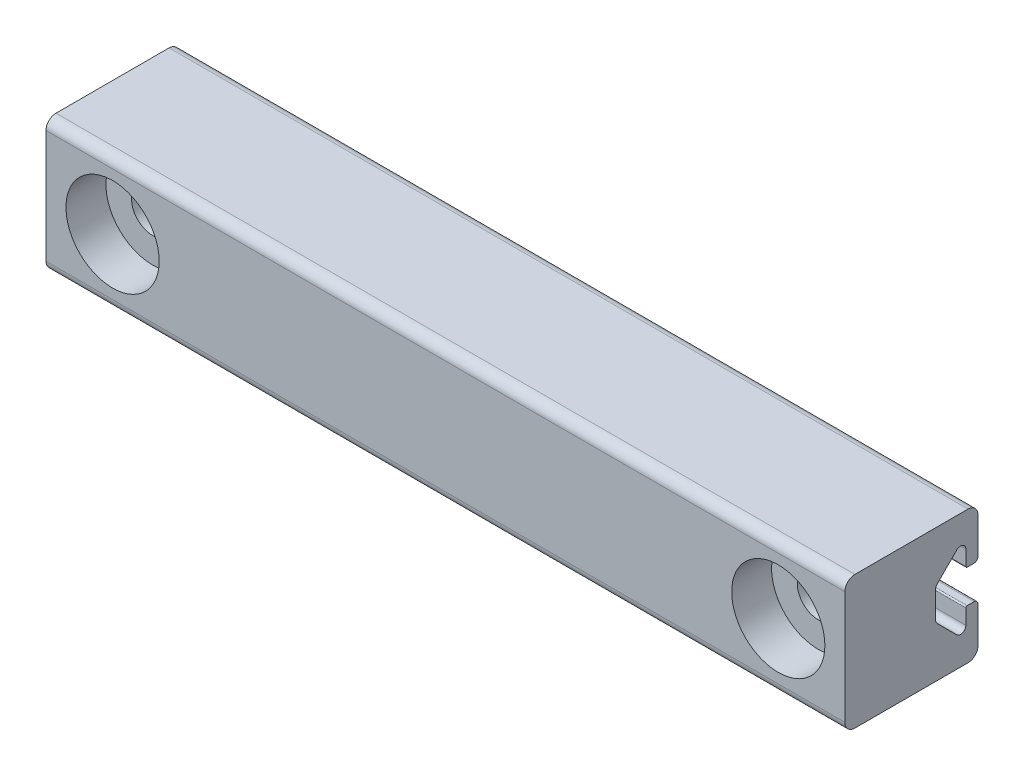
from build123d import *
from build123d.topology import SkipClean

# Parameters (mm, degrees)
BOSS_EXTRUDE1_DEPTH      = 152.4
BOSS_EXTRUDE1_DEPTH_BACK = 152.4
SKETCH4_R                = 2.15
BOSS_EXTRUDE2_DEPTH      = 95.2
SKETCH5_W                = 30
SKETCH5_H                = 30
CUT_EXTRUDE1_DEPTH       = 280
BOSS_EXTRUDE5_START      = -120
BOSS_EXTRUDE5_DEPTH      = 120
SKETCH9_R                = 3.15
CUT_EXTRUDE2_DEPTH       = 155.031685052
SKETCH10_R               = 7
CUT_EXTRUDE3_DEPTH       = 6


with BuildPart() as part:
    # Sketch3 → Boss-Extrude1 (new, two sides: drawn at the far end of the back side and taken through both)
    with BuildSketch(Plane(origin=(0, 0, 0), x_dir=(0, 0, -1), z_dir=(1, 0, 0)).offset(-BOSS_EXTRUDE1_DEPTH_BACK)):
        with BuildLine():
            Line((-5.515685425, 6.807463915), (-2.601114729, 3.892893219))
            ThreePointArc((-2.601114729, 3.892893219), (-2.27669138, 3.676120467), (-1.894007948, 3.6))
            Line((-1.894007948, 3.6), (0, 3.6))
            Line((0, 3.6), (0, 2.15))
            ThreePointArc((0, 2.15), (-1.52027958, 1.52027958), (-2.15, 0))
            Line((-2.15, 0), (-3.6, 0))
            Line((-3.6, 0), (-3.6, 1.894007948))
            ThreePointArc((-3.6, 1.894007948), (-3.676120467, 2.27669138), (-3.892893219, 2.601114729))
            Line((-3.892893219, 2.601114729), (-6.807463915, 5.515685425))
            ThreePointArc((-6.807463915, 5.515685425), (-7.679296086, 5.689103626), (-8.17314934, 4.95))
            Line((-8.17314934, 4.95), (-8.17314934, 2.7))
            ThreePointArc((-8.17314934, 2.7), (-8.231727984, 2.558578644), (-8.37314934, 2.5))
            Line((-8.37314934, 2.5), (-9.4, 2.5))
            ThreePointArc((-9.4, 2.5), (-9.824264069, 2.675735931), (-10, 3.1))
            Line((-10, 3.1), (-10, 8.5))
            ThreePointArc((-10, 8.5), (-9.560660172, 9.560660172), (-8.5, 10))
            Line((-8.5, 10), (-3.1, 10))
            ThreePointArc((-3.1, 10), (-2.675735931, 9.824264069), (-2.5, 9.4))
            Line((-2.5, 9.4), (-2.5, 8.37314934))
            ThreePointArc((-2.5, 8.37314934), (-2.558578644, 8.231727984), (-2.7, 8.17314934))
            Line((-2.7, 8.17314934), (-4.95, 8.17314934))
            ThreePointArc((-4.95, 8.17314934), (-5.689103626, 7.679296086), (-5.515685425, 6.807463915))
        make_face()
    extrude(amount=BOSS_EXTRUDE1_DEPTH + BOSS_EXTRUDE1_DEPTH_BACK)

    # Mirror1: part across plane


with BuildPart() as part_1:
    add(part.part)
    add(part.part.mirror(Plane.ZX))

    # Mirror2: part across plane


with BuildPart() as part_2:
    add(part_1.part)
    add(part_1.part.mirror(Plane.XY))

    # Sketch4 → Boss-Extrude2 (add)
    with SkipClean():  # the faces are left unmerged after this step: merging them gives an invalid solid
        with BuildSketch(Plane(origin=(152.4, 0, 0), x_dir=(0, 0, -1), z_dir=(1, 0, 0))):
            with BuildLine():
                Line((1.894007948, 3.6), (-1.894007948, 3.6))
                ThreePointArc((-1.894007948, 3.6), (-2.27669138, 3.676120467), (-2.601114729, 3.892893219))
                Line((-2.601114729, 3.892893219), (-5.515685425, 6.807463915))
                ThreePointArc((-5.515685425, 6.807463915), (-5.689103626, 7.679296086), (-4.95, 8.17314934))
                Line((-4.95, 8.17314934), (-2.7, 8.17314934))
                ThreePointArc((-2.7, 8.17314934), (-2.558578644, 8.231727984), (-2.5, 8.37314934))
                Line((-2.5, 8.37314934), (-2.5, 9.4))
                ThreePointArc((-2.5, 9.4), (-2.675735931, 9.824264069), (-3.1, 10))
                Line((-3.1, 10), (-8.5, 10))
                ThreePointArc((-8.5, 10), (-9.560660172, 9.560660172), (-10, 8.5))
                Line((-10, 8.5), (-10, 3.1))
                ThreePointArc((-10, 3.1), (-9.824264069, 2.675735931), (-9.4, 2.5))
                Line((-9.4, 2.5), (-8.37314934, 2.5))
                ThreePointArc((-8.37314934, 2.5), (-8.231727984, 2.558578644), (-8.17314934, 2.7))
                Line((-8.17314934, 2.7), (-8.17314934, 4.95))
                ThreePointArc((-8.17314934, 4.95), (-7.679296086, 5.689103626), (-6.807463915, 5.515685425))
                Line((-6.807463915, 5.515685425), (-3.892893219, 2.601114729))
                ThreePointArc((-3.892893219, 2.601114729), (-3.676120467, 2.27669138), (-3.6, 1.894007948))
                Line((-3.6, 1.894007948), (-3.6, -1.894007948))
                ThreePointArc((-3.6, -1.894007948), (-3.676120467, -2.27669138), (-3.892893219, -2.601114729))
                Line((-3.892893219, -2.601114729), (-6.807463915, -5.515685425))
                ThreePointArc((-6.807463915, -5.515685425), (-7.679296086, -5.689103626), (-8.17314934, -4.95))
                Line((-8.17314934, -4.95), (-8.17314934, -2.7))
                ThreePointArc((-8.17314934, -2.7), (-8.231727984, -2.558578644), (-8.37314934, -2.5))
                Line((-8.37314934, -2.5), (-9.4, -2.5))
                ThreePointArc((-9.4, -2.5), (-9.824264069, -2.675735931), (-10, -3.1))
                Line((-10, -3.1), (-10, -8.5))
                ThreePointArc((-10, -8.5), (-9.560660172, -9.560660172), (-8.5, -10))
                Line((-8.5, -10), (-3.1, -10))
                ThreePointArc((-3.1, -10), (-2.675735931, -9.824264069), (-2.5, -9.4))
                Line((-2.5, -9.4), (-2.5, -8.37314934))
                ThreePointArc((-2.5, -8.37314934), (-2.558578644, -8.231727984), (-2.7, -8.17314934))
                Line((-2.7, -8.17314934), (-4.95, -8.17314934))
                ThreePointArc((-4.95, -8.17314934), (-5.689103626, -7.679296086), (-5.515685425, -6.807463915))
                Line((-5.515685425, -6.807463915), (-2.601114729, -3.892893219))
                ThreePointArc((-2.601114729, -3.892893219), (-2.27669138, -3.676120467), (-1.894007948, -3.6))
                Line((-1.894007948, -3.6), (1.894007948, -3.6))
                ThreePointArc((1.894007948, -3.6), (2.27669138, -3.676120467), (2.601114729, -3.892893219))
                Line((2.601114729, -3.892893219), (5.515685425, -6.807463915))
                ThreePointArc((5.515685425, -6.807463915), (5.689103626, -7.679296086), (4.95, -8.17314934))
                Line((4.95, -8.17314934), (2.7, -8.17314934))
                ThreePointArc((2.7, -8.17314934), (2.558578644, -8.231727984), (2.5, -8.37314934))
                Line((2.5, -8.37314934), (2.5, -9.4))
                ThreePointArc((2.5, -9.4), (2.675735931, -9.824264069), (3.1, -10))
                Line((3.1, -10), (8.5, -10))
                ThreePointArc((8.5, -10), (9.560660172, -9.560660172), (10, -8.5))
                Line((10, -8.5), (10, -3.1))
                ThreePointArc((10, -3.1), (9.824264069, -2.675735931), (9.4, -2.5))
                Line((9.4, -2.5), (8.37314934, -2.5))
                ThreePointArc((8.37314934, -2.5), (8.231727984, -2.558578644), (8.17314934, -2.7))
                Line((8.17314934, -2.7), (8.17314934, -4.95))
                ThreePointArc((8.17314934, -4.95), (7.679296086, -5.689103626), (6.807463915, -5.515685425))
                Line((6.807463915, -5.515685425), (3.892893219, -2.601114729))
                ThreePointArc((3.892893219, -2.601114729), (3.676120467, -2.27669138), (3.6, -1.894007948))
                Line((3.6, -1.894007948), (3.6, 1.894007948))
                ThreePointArc((3.6, 1.894007948), (3.676120467, 2.27669138), (3.892893219, 2.601114729))
                Line((3.892893219, 2.601114729), (6.807463915, 5.515685425))
                ThreePointArc((6.807463915, 5.515685425), (7.679296086, 5.689103626), (8.17314934, 4.95))
                Line((8.17314934, 4.95), (8.17314934, 2.7))
                ThreePointArc((8.17314934, 2.7), (8.231727984, 2.558578644), (8.37314934, 2.5))
                Line((8.37314934, 2.5), (9.4, 2.5))
                ThreePointArc((9.4, 2.5), (9.824264069, 2.675735931), (10, 3.1))
                Line((10, 3.1), (10, 8.5))
                ThreePointArc((10, 8.5), (9.560660172, 9.560660172), (8.5, 10))
                Line((8.5, 10), (3.1, 10))
                ThreePointArc((3.1, 10), (2.675735931, 9.824264069), (2.5, 9.4))
                Line((2.5, 9.4), (2.5, 8.37314934))
                ThreePointArc((2.5, 8.37314934), (2.558578644, 8.231727984), (2.7, 8.17314934))
                Line((2.7, 8.17314934), (4.95, 8.17314934))
                ThreePointArc((4.95, 8.17314934), (5.689103626, 7.679296086), (5.515685425, 6.807463915))
                Line((5.515685425, 6.807463915), (2.601114729, 3.892893219))
                ThreePointArc((2.601114729, 3.892893219), (2.27669138, 3.676120467), (1.894007948, 3.6))
            make_face()
            Circle(SKETCH4_R, mode=Mode.SUBTRACT)
        extrude(amount=BOSS_EXTRUDE2_DEPTH)

    # Sketch5 → Cut-Extrude1 (cut)
    with BuildSketch(Plane(origin=(247.6, 0, 0), x_dir=(0, 0, -1), z_dir=(1, 0, 0))):
        Rectangle(SKETCH5_W, SKETCH5_H)
    extrude(amount=-CUT_EXTRUDE1_DEPTH, mode=Mode.SUBTRACT)

    # Sketch8 → Boss-Extrude5 (add)
    with BuildSketch(Plane(origin=(-32.4, 0, 0), x_dir=(0, 0, -1), z_dir=(1, 0, 0)).offset(BOSS_EXTRUDE5_START)):
        with BuildLine():
            Line((-8.5, 10), (8.5, 10))
            ThreePointArc((8.5, 10), (9.560660172, 9.560660172), (10, 8.5))
            Line((10, 8.5), (10, 3.1))
            ThreePointArc((10, 3.1), (9.824264069, 2.675735931), (9.4, 2.5))
            Line((9.4, 2.5), (8.37314934, 2.5))
            ThreePointArc((8.37314934, 2.5), (8.231727984, 2.558578644), (8.17314934, 2.7))
            Line((8.17314934, 2.7), (8.17314934, 4.95))
            ThreePointArc((8.17314934, 4.95), (7.679296086, 5.689103626), (6.807463915, 5.515685425))
            Line((6.807463915, 5.515685425), (3.892893219, 2.601114729))
            ThreePointArc((3.892893219, 2.601114729), (3.676120467, 2.27669138), (3.6, 1.894007948))
            Line((3.6, 1.894007948), (3.6, -1.894007948))
            ThreePointArc((3.6, -1.894007948), (3.676120467, -2.27669138), (3.892893219, -2.601114729))
            Line((3.892893219, -2.601114729), (6.807463915, -5.515685425))
            ThreePointArc((6.807463915, -5.515685425), (7.679296086, -5.689103626), (8.17314934, -4.95))
            Line((8.17314934, -4.95), (8.17314934, -2.7))
            ThreePointArc((8.17314934, -2.7), (8.231727984, -2.558578644), (8.37314934, -2.5))
            Line((8.37314934, -2.5), (9.4, -2.5))
            ThreePointArc((9.4, -2.5), (9.824264069, -2.675735931), (10, -3.1))
            Line((10, -3.1), (10, -8.5))
            ThreePointArc((10, -8.5), (9.560660172, -9.560660172), (8.5, -10))
            Line((8.5, -10), (-8.5, -10))
            ThreePointArc((-8.5, -10), (-9.560660172, -9.560660172), (-10, -8.5))
            Line((-10, -8.5), (-10, 8.5))
            ThreePointArc((-10, 8.5), (-9.560660172, 9.560660172), (-8.5, 10))
        make_face()
    extrude(amount=BOSS_EXTRUDE5_DEPTH)

    # Sketch9 → Cut-Extrude2 (cut, through all)
    with BuildSketch(Plane.XY.offset(10)):
        with Locations((-142.4, 0)):
            Circle(SKETCH9_R)
        with Locations((-42.4, 0)):
            Circle(SKETCH9_R)
    extrude(amount=-CUT_EXTRUDE2_DEPTH, mode=Mode.SUBTRACT)

    # Sketch10 → Cut-Extrude3 (cut)
    with BuildSketch(Plane.XY.offset(10)):
        with Locations((-142.4, 0)):
            Circle(SKETCH10_R)
        with Locations((-42.4, 0)):
            Circle(SKETCH10_R)
    extrude(amount=-CUT_EXTRUDE3_DEPTH, mode=Mode.SUBTRACT)


solid = part_2.part
